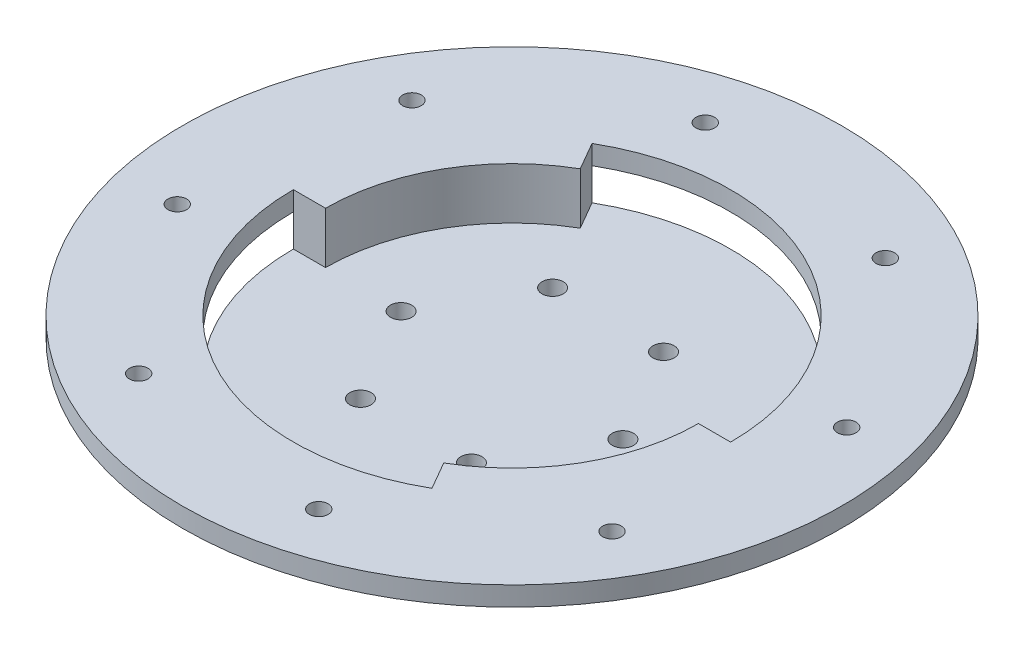
from build123d import *

# Parameters (mm, degrees)
SKETCH_1_R                     = 34
EXTRUDE_2_DEPTH                = 5
EXTRUDE_3_DEPTH                = 8
EXTRUDE_START                  = -3
SKETCH_3_R                     = 46.25
SKETCH_3_R_2                   = 34
EXTRUDE_4_DEPTH                = 3
EXTRUDE_5_DEPTH                = 27.3
EXTRUDE_5_DEPTH_BACK           = 3
SKETCH_4_R                     = 51.25
SKETCH_4_R_2                   = 46.25
SKETCH_5_R                     = 58
SKETCH_5_R_2                   = 51.25
EXTRUDE_6_DEPTH                = 5
HOLE_WIZARD_M4_1_D             = 3.3
HOLE_WIZARD_M4_1_CSINK_D       = 4.05
HOLE_WIZARD_M4_1_CSINK_ANGLE   = 90
PATTERN_CIRCULAR_1_COUNT       = 6
HOLE_WIZARD_M3_5_1_D           = 2.9
HOLE_WIZARD_M3_5_1_CSINK_D     = 3.55
HOLE_WIZARD_M3_5_1_CSINK_ANGLE = 90
PATTERN_CIRCULAR_2_COUNT       = 8
SKETCH_10_R                    = 58
CUT_EXTRUDE_1_DEPTH            = 27.3


with BuildPart() as part:
    # 草图1 → 凸台-拉伸2 (new body)
    with BuildSketch(Plane(origin=(0, 0, 0), x_dir=(1, 0, 0), z_dir=(0, 1, 0))):
        Circle(SKETCH_1_R)
    extrude(amount=EXTRUDE_2_DEPTH)

    # 草图2 → 凸台-拉伸3 (add)
    with BuildSketch(Plane(origin=(0, 5, 0), x_dir=(1, 0, 0), z_dir=(0, 1, 0))):
        with BuildLine():
            Line((-34, 0), (-29, 0))
            ThreePointArc((-29, 0), (-25.11473671, 14.5), (-14.5, 25.11473671))
            Line((-14.5, 25.11473671), (-17, 29.444863729))
            ThreePointArc((-17, 29.444863729), (-29.444863729, 17), (-34, 0))
        make_face()
        with BuildLine():
            Line((29, 0), (34, 0))
            ThreePointArc((34, 0), (29.444863729, -17), (17, -29.444863729))
            Line((17, -29.444863729), (14.5, -25.11473671))
            ThreePointArc((14.5, -25.11473671), (25.11473671, -14.5), (29, 0))
        make_face()
    extrude(amount=EXTRUDE_3_DEPTH)

    # 草图3 → 凸台-拉伸4 (add)
    with BuildSketch(Plane(origin=(0, 13, 0), x_dir=(1, 0, 0), z_dir=(0, 1, 0)).offset(EXTRUDE_START)):
        Circle(SKETCH_3_R)
        Circle(SKETCH_3_R_2, mode=Mode.SUBTRACT)
    extrude(amount=EXTRUDE_4_DEPTH)

    # 草图4 → 凸台-拉伸5 (add, two sides: drawn at the far end of the back side and taken through both)
    with BuildSketch(Plane(origin=(0, 13, 0), x_dir=(1, 0, 0), z_dir=(0, 1, 0)).offset(-EXTRUDE_5_DEPTH_BACK)):
        Circle(SKETCH_4_R)
        Circle(SKETCH_4_R_2, mode=Mode.SUBTRACT)
    extrude(amount=EXTRUDE_5_DEPTH + EXTRUDE_5_DEPTH_BACK)

    # 草图5 → 凸台-拉伸6 (add)
    with BuildSketch(Plane(origin=(0, 40.3, 0), x_dir=(1, 0, 0), z_dir=(0, 1, 0))):
        Circle(SKETCH_5_R)
        Circle(SKETCH_5_R_2, mode=Mode.SUBTRACT)
    extrude(amount=-EXTRUDE_6_DEPTH)

    # M4 螺纹孔1 (through all)
    with Locations(Plane.XZ):
        with Locations((8.625, -14.938938215)):
            hole_wizard_m4_1 = CounterSinkHole(HOLE_WIZARD_M4_1_D / 2, HOLE_WIZARD_M4_1_CSINK_D / 2, counter_sink_angle=HOLE_WIZARD_M4_1_CSINK_ANGLE)

    # 阵列(圆周)1: M4 螺纹孔1 ×6 about axis
    pattern_circular_1_axis = Axis((0, 0, 0), (0, 1, 0))
    for i in range(1, PATTERN_CIRCULAR_1_COUNT):
        add(hole_wizard_m4_1.rotate(pattern_circular_1_axis, i * 360 / PATTERN_CIRCULAR_1_COUNT), mode=Mode.SUBTRACT)

    # M3.5 螺纹孔1 (through all)
    with Locations(Plane.XZ.offset(-10)):
        with Locations((36.806079661, 21.25)):
            hole_wizard_m3_5_1 = CounterSinkHole(HOLE_WIZARD_M3_5_1_D / 2, HOLE_WIZARD_M3_5_1_CSINK_D / 2, counter_sink_angle=HOLE_WIZARD_M3_5_1_CSINK_ANGLE)

    # 阵列(圆周)2: M3.5 螺纹孔1 ×8 about axis
    pattern_circular_2_axis = Axis((0, 0, 0), (0, 1, 0))
    for i in range(1, PATTERN_CIRCULAR_2_COUNT):
        add(hole_wizard_m3_5_1.rotate(pattern_circular_2_axis, i * 360 / PATTERN_CIRCULAR_2_COUNT), mode=Mode.SUBTRACT)

    # 草图10 → 切除-拉伸1 (cut)
    with BuildSketch(Plane(origin=(0, 40.3, 0), x_dir=(1, 0, 0), z_dir=(0, 1, 0))):
        Circle(SKETCH_10_R)
    extrude(amount=-CUT_EXTRUDE_1_DEPTH, mode=Mode.SUBTRACT)


solid = part.part
